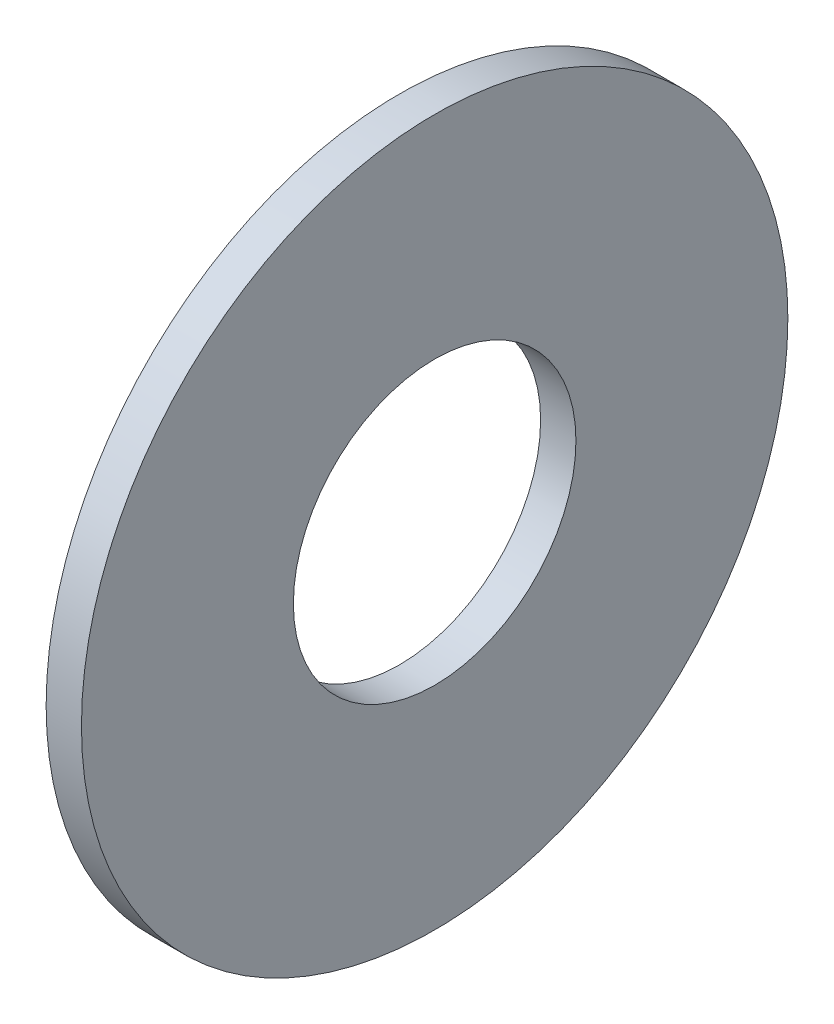
from build123d import *

# Parameters (mm, degrees)
SKETCH2_R           = 10
SKETCH2_R_2         = 4
BOSS_EXTRUDE1_DEPTH = 1


with BuildPart() as part:
    # Sketch2 → Boss-Extrude1 (new body)
    with BuildSketch(Plane(origin=(0, 0, 0), x_dir=(0, 0, -1), z_dir=(1, 0, 0))):
        Circle(SKETCH2_R)
        Circle(SKETCH2_R_2, mode=Mode.SUBTRACT)
    extrude(amount=BOSS_EXTRUDE1_DEPTH)


solid = part.part
